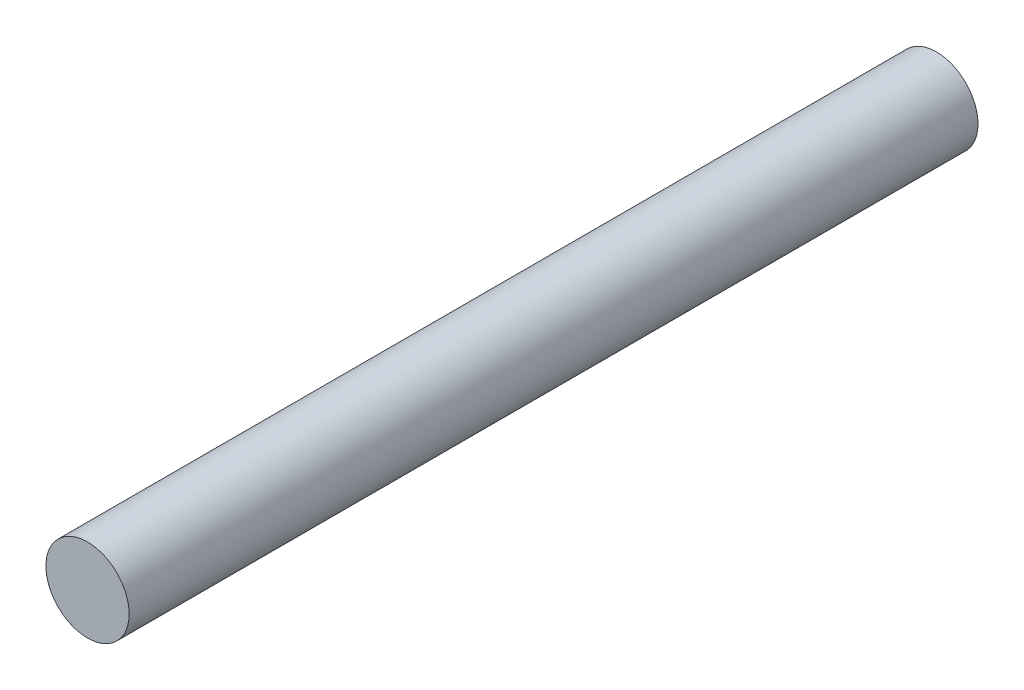
from build123d import *

# Parameters (mm, degrees)
SKETCH1_W = 51
SKETCH1_H = 2.5


with BuildPart() as part:
    # Sketch1 → Revolve1 (revolve)
    with BuildSketch(Plane(origin=(0, 0, 0), x_dir=(0, 0, -1), z_dir=(1, 0, 0)), mode=Mode.PRIVATE) as revolve1_sk:
        with Locations((0, 1.25)):
            Rectangle(SKETCH1_W, SKETCH1_H)
    revolve(revolve1_sk.sketch.rotate(Axis((0, 0, 25.5), (0, 0, -1)), 90), axis=Axis((0, 0, 25.5), (0, 0, -1)))


solid = part.part
